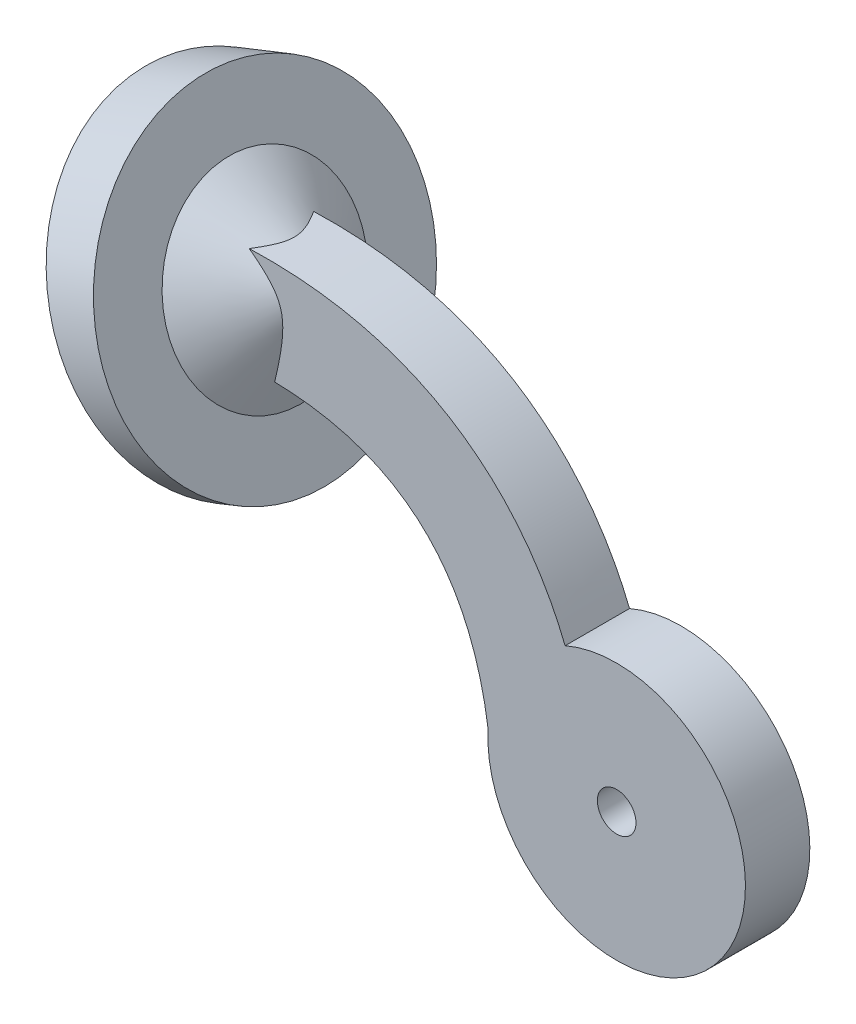
from build123d import *

# Parameters (mm, degrees)
SKETCH1_R           = 10
BOSS_EXTRUDE1_DEPTH = 5
BOSS_EXTRUDE2_DEPTH = 5
SKETCH3_R           = 12.5
BOSS_EXTRUDE3_DEPTH = 5
SKETCH5_R           = 7.5
BOSS_EXTRUDE4_DEPTH = 5
BOSS_EXTRUDE4_TAPER = 52
CUT_EXTRUDE4_DEPTH  = 26
SKETCH12_R          = 1.5
CUT_EXTRUDE5_DEPTH  = 10


with BuildPart() as part:
    # Sketch1 → Boss-Extrude1 (new body)
    with BuildSketch(Plane.XY):
        Circle(SKETCH1_R)
    extrude(amount=BOSS_EXTRUDE1_DEPTH)

    # Sketch2 → Boss-Extrude2 (add)
    with BuildSketch(Plane(origin=(0, 0, 0), x_dir=(-1, 0, 0), z_dir=(0, 0, -1))):
        with BuildLine():
            Line((28.226697949, 15.611392499), (31.387852607, 23.606970284))
            Line((31.387852607, 23.606970284), (28.492660152, 23.606970284))
            add(Edge.make_bspline(
                [(1.702274754, -2.039901693), (1.751506914, -1.119618262), (1.905629401, 0.736300837), (2.439985578, 4.279152464), (3.573593312, 8.507619636), (5.826230301, 13.181920176), (9.085989857, 17.262755922), (13.259055966, 20.42976386), (18.030055154, 22.500703416), (22.280120083, 23.371095334), (25.78433669, 23.636661982), (27.595284541, 23.636820284), (28.492660152, 23.606970284)],
                knots=[0, 0, 0, 0, 0.0625, 0.125, 0.25, 0.375, 0.5, 0.625, 0.75, 0.875, 0.9375, 1, 1, 1, 1], degree=3))
            Line((1.702274754, -2.039901693), (9.690851664, -2.467264483))
            add(Edge.make_bspline(
                [(9.690851664, -2.467264483), (10.68920872, 16.194753627), (28.226697949, 15.611392499)],
                knots=[0, 0, 0, 1, 1, 1], degree=2))
        make_face()
    extrude(amount=-BOSS_EXTRUDE2_DEPTH)

    # Sketch3 → Boss-Extrude3 (add)
    with BuildSketch(Plane(origin=(-19.073171032, -7.540823824, 0), x_dir=(0, 0, 1), z_dir=(-0.9299562551595503, -0.3676701830304238, 0))):
        with Locations(Location((2.5, 29.194927251, 0), (0, 0, 270))):
            Circle(SKETCH3_R)
    extrude(amount=BOSS_EXTRUDE3_DEPTH)

    # Sketch5 → Boss-Extrude4 (add)
    with BuildSketch(Plane(origin=(-19.073171032, -7.540823824, 0), x_dir=(0, 0, -1), z_dir=(0.9299562551595503, 0.3676701830304238, 0))):
        with Locations((-2.5, 29.194927251)):
            Circle(SKETCH5_R)
    extrude(amount=BOSS_EXTRUDE4_DEPTH, taper=BOSS_EXTRUDE4_TAPER)

    # Sketch11 → Cut-Extrude4 (cut)
    with BuildSketch(Plane.XY.offset(15)):
        Polygon((-39.052933842, 29.395283666), (-26.628493881, 7.42446109), (-33.620316113, 1.865469744), align=None)
    extrude(amount=-CUT_EXTRUDE4_DEPTH, mode=Mode.SUBTRACT)

    # Sketch12 → Cut-Extrude5 (cut)
    with BuildSketch(Plane(origin=(0, 0, 0), x_dir=(-1, 0, 0), z_dir=(0, 0, -1))):
        Circle(SKETCH12_R)
    extrude(amount=-CUT_EXTRUDE5_DEPTH, mode=Mode.SUBTRACT)


solid = part.part
